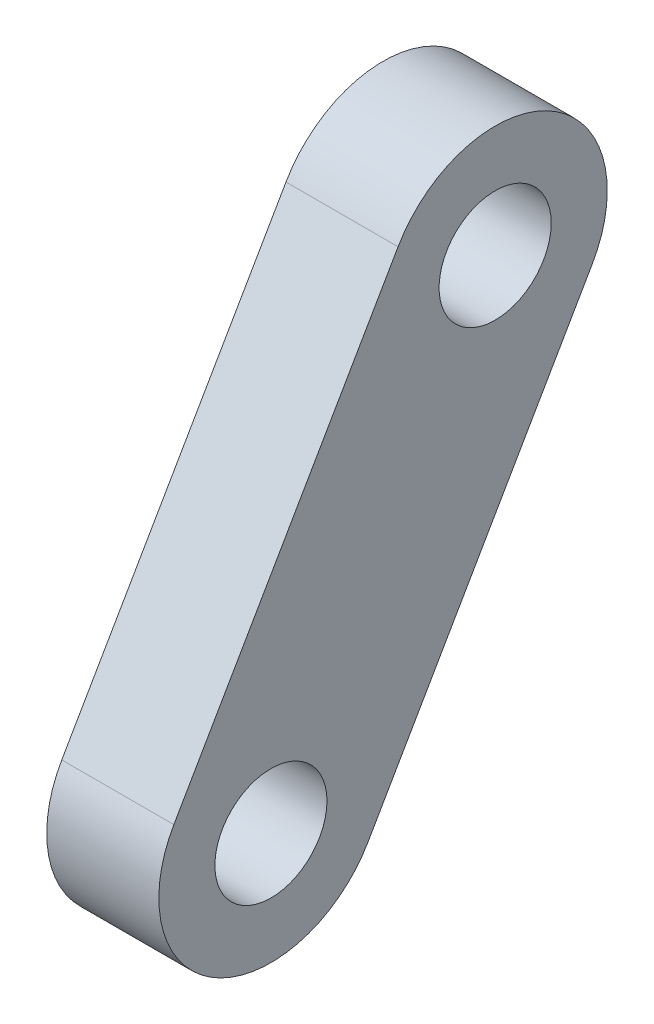
from build123d import *

# Parameters (mm, degrees)
SKETCH1_R           = 5
SKETCH1_R_2         = 2.5
BOSS_EXTRUDE1_DEPTH = 5


with BuildPart() as part:
    # Sketch1 → Boss-Extrude1 (new body)
    # profile 1 of 3: a face of its own
    with BuildSketch(Plane(origin=(0, 0, 0), x_dir=(0, 0, -1), z_dir=(1, 0, 0))):
        with BuildLine():
            Line((5.669872981, 19.820508076), (-4.330127019, 2.5))
            ThreePointArc((-4.330127019, 2.5), (1.294095226, 4.829629131), (5, 0))
            ThreePointArc((5, 0), (4.829629131, -1.294095226), (4.330127019, -2.5))
            Line((4.330127019, -2.5), (14.330127019, 14.820508076))
            ThreePointArc((14.330127019, 14.820508076), (7.5, 12.990381057), (5.669872981, 19.820508076))
        make_face()
    # profile 2 of 3: a face of its own
    with BuildSketch(Plane(origin=(0, 0, 0), x_dir=(0, 0, -1), z_dir=(1, 0, 0))):
        with Locations((10, 17.320508076)):
            Circle(SKETCH1_R)
        with Locations((10, 17.320508076)):
            Circle(SKETCH1_R_2, mode=Mode.SUBTRACT)
    # profile 3 of 3: a face of its own
    with BuildSketch(Plane(origin=(0, 0, 0), x_dir=(0, 0, -1), z_dir=(1, 0, 0))):
        Circle(SKETCH1_R)
        Circle(SKETCH1_R_2, mode=Mode.SUBTRACT)
    extrude(amount=BOSS_EXTRUDE1_DEPTH)


solid = part.part
